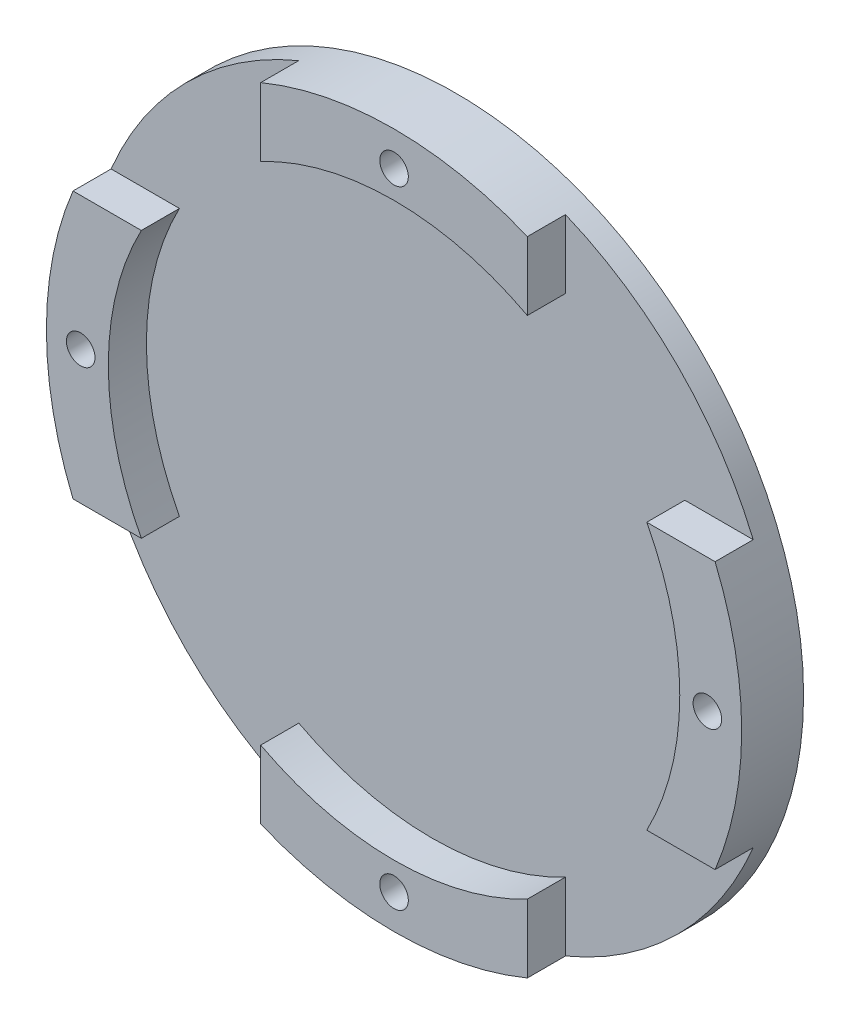
from build123d import *

# Parameters (mm, degrees)
SKETCH_1_R          = 36.5
EXTRUDE_1_DEPTH     = 6.5
CUT_EXTRUDE_START   = -4
CUT_EXTRUDE_2_DEPTH = 4
CUT_EXTRUDE_3_DEPTH = 4
SKETCH_6_R          = 1.5
CUT_EXTRUDE_5_DEPTH = 53.026435588
CUT_EXTRUDE_6_DEPTH = 2.2


with BuildPart() as part:
    # 草图1 → 凸台-拉伸1 (new body)
    with BuildSketch(Plane.XY):
        with Locations(Location((0, 0, 0), (0, 0, 180))):
            Circle(SKETCH_1_R)
    extrude(amount=EXTRUDE_1_DEPTH)

    # 草图3 → 切除-拉伸2 (cut)
    with BuildSketch(Plane.XY.offset(6.5).offset(CUT_EXTRUDE_START)):
        with BuildLine():
            Line((14, 33.708307581), (14, 26.532998323))
            ThreePointArc((14, 26.532998323), (21.213203436, 21.213203436), (26.532998323, 14))
            Line((26.532998323, 14), (33.708307581, 14))
            ThreePointArc((33.708307581, 14), (25.809397513, 25.809397513), (14, 33.708307581))
        make_face()
        with BuildLine():
            ThreePointArc((26.532998323, -14), (21.213203436, -21.213203436), (14, -26.532998323))
            Line((14, -26.532998323), (14, -33.708307581))
            ThreePointArc((14, -33.708307581), (25.809397513, -25.809397513), (33.708307581, -14))
            Line((33.708307581, -14), (26.532998323, -14))
        make_face()
        with BuildLine():
            Line((-14, -33.708307581), (-14, -26.532998323))
            ThreePointArc((-14, -26.532998323), (-21.213203436, -21.213203436), (-26.532998323, -14))
            Line((-26.532998323, -14), (-33.708307581, -14))
            ThreePointArc((-33.708307581, -14), (-25.809397513, -25.809397513), (-14, -33.708307581))
        make_face()
        with BuildLine():
            Line((-33.708307581, 14), (-26.532998323, 14))
            ThreePointArc((-26.532998323, 14), (-21.213203436, 21.213203436), (-14, 26.532998323))
            Line((-14, 26.532998323), (-14, 33.708307581))
            ThreePointArc((-14, 33.708307581), (-25.809397513, 25.809397513), (-33.708307581, 14))
        make_face()
    extrude(amount=CUT_EXTRUDE_2_DEPTH, mode=Mode.SUBTRACT)

    # 草图4 → 切除-拉伸3 (cut)
    with BuildSketch(Plane.XY.offset(6.5).offset(CUT_EXTRUDE_START)):
        with BuildLine():
            ThreePointArc((26.532998323, -14), (29.120353275, -7.211450974), (30, 0))
            ThreePointArc((30, 0), (29.120353275, 7.211450974), (26.532998323, 14))
            ThreePointArc((26.532998323, 14), (21.213203436, 21.213203436), (14, 26.532998323))
            ThreePointArc((14, 26.532998323), (0, 30), (-14, 26.532998323))
            ThreePointArc((-14, 26.532998323), (-21.213203436, 21.213203436), (-26.532998323, 14))
            ThreePointArc((-26.532998323, 14), (-30, 0), (-26.532998323, -14))
            ThreePointArc((-26.532998323, -14), (-21.213203436, -21.213203436), (-14, -26.532998323))
            ThreePointArc((-14, -26.532998323), (0, -30), (14, -26.532998323))
            ThreePointArc((14, -26.532998323), (21.213203436, -21.213203436), (26.532998323, -14))
        make_face()
    extrude(amount=CUT_EXTRUDE_3_DEPTH, mode=Mode.SUBTRACT)

    # 草图6 → 切除-拉伸5 (cut, through all)
    with BuildSketch(Plane(origin=(0, 0, 0), x_dir=(-1, 0, 0), z_dir=(0, 0, -1))):
        with Locations((32.9, 0)):
            Circle(SKETCH_6_R)
        with Locations((0, -32.9)):
            Circle(SKETCH_6_R)
        with Locations((0, 32.9)):
            Circle(SKETCH_6_R)
        with Locations((-32.9, 0)):
            Circle(SKETCH_6_R)
    extrude(amount=-CUT_EXTRUDE_5_DEPTH, mode=Mode.SUBTRACT)

    # 草图8 → 切除-拉伸6 (cut)
    with BuildSketch(Plane(origin=(0, 0, 0), x_dir=(-1, 0, 0), z_dir=(0, 0, -1))):
        Polygon((-29.998814897, -1.675), (-29.998814897, 1.675), (-32.9, 3.35), (-35.801185103, 1.675), (-35.801185103, -1.675), (-32.9, -3.35), align=None)
        Polygon((1.675, -35.801185103), (3.35, -32.9), (1.675, -29.998814897), (-1.675, -29.998814897), (-3.35, -32.9), (-1.675, -35.801185103), align=None)
        Polygon((35.801185103, -1.675), (35.801185103, 1.675), (32.9, 3.35), (29.998814897, 1.675), (29.998814897, -1.675), (32.9, -3.35), align=None)
        Polygon((1.675, 29.998814897), (3.35, 32.9), (1.675, 35.801185103), (-1.675, 35.801185103), (-3.35, 32.9), (-1.675, 29.998814897), align=None)
    extrude(amount=-CUT_EXTRUDE_6_DEPTH, mode=Mode.SUBTRACT)


solid = part.part
